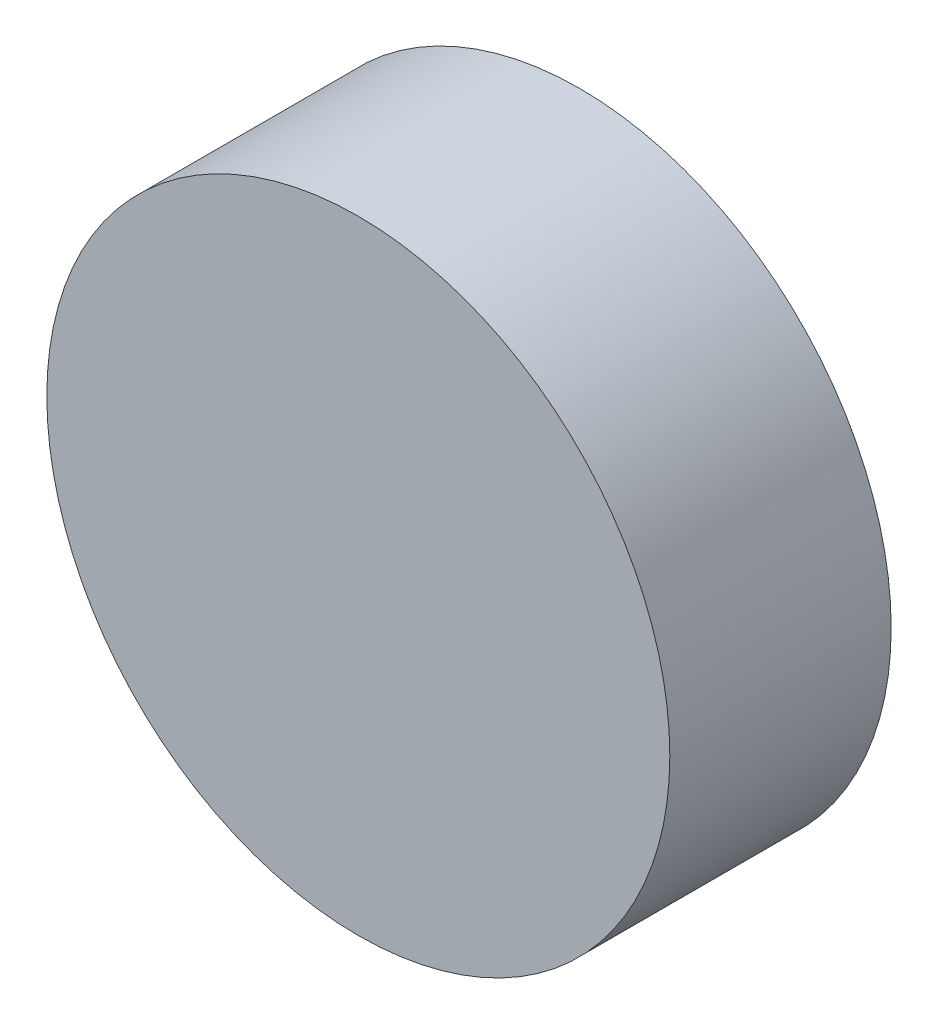
from build123d import *

# Parameters (mm, degrees)
SKETCH1_R           = 71.4883
BOSS_EXTRUDE1_DEPTH = 50.8


with BuildPart() as part:
    # Sketch1 → Boss-Extrude1 (new body)
    with BuildSketch(Plane.XY):
        Circle(SKETCH1_R)
    extrude(amount=BOSS_EXTRUDE1_DEPTH)


solid = part.part
